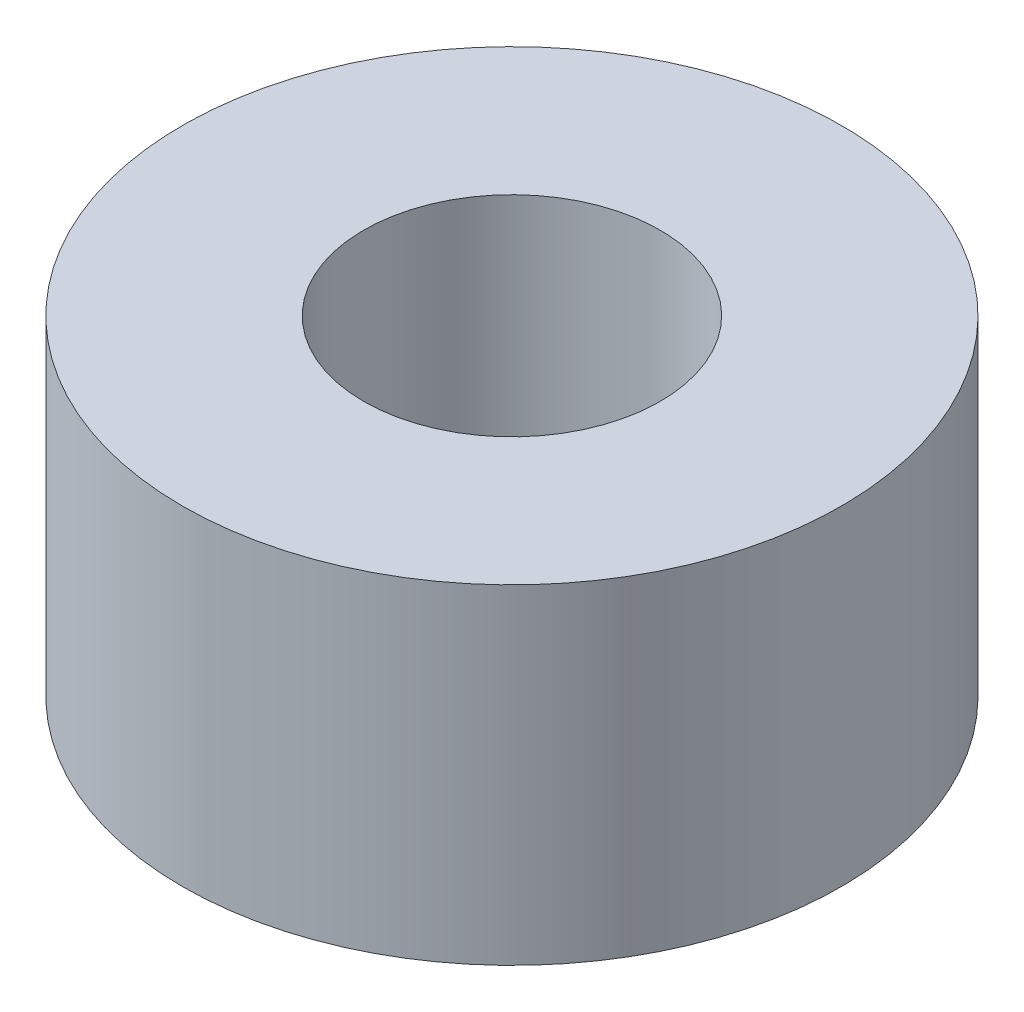
from build123d import *

# Parameters (mm, degrees)
SKETCH1_R           = 4
SKETCH1_R_2         = 1.8
BOSS_EXTRUDE1_DEPTH = 4


with BuildPart() as part:
    # Sketch1 → Boss-Extrude1 (new body)
    with BuildSketch(Plane(origin=(0, 0, 0), x_dir=(1, 0, 0), z_dir=(0, 1, 0))):
        with Locations(Location((0, 0, 0), (0, 0, 270))):
            Circle(SKETCH1_R)
        with Locations(Location((0, 0, 0), (0, 0, 270))):
            Circle(SKETCH1_R_2, mode=Mode.SUBTRACT)
    extrude(amount=BOSS_EXTRUDE1_DEPTH)


solid = part.part
